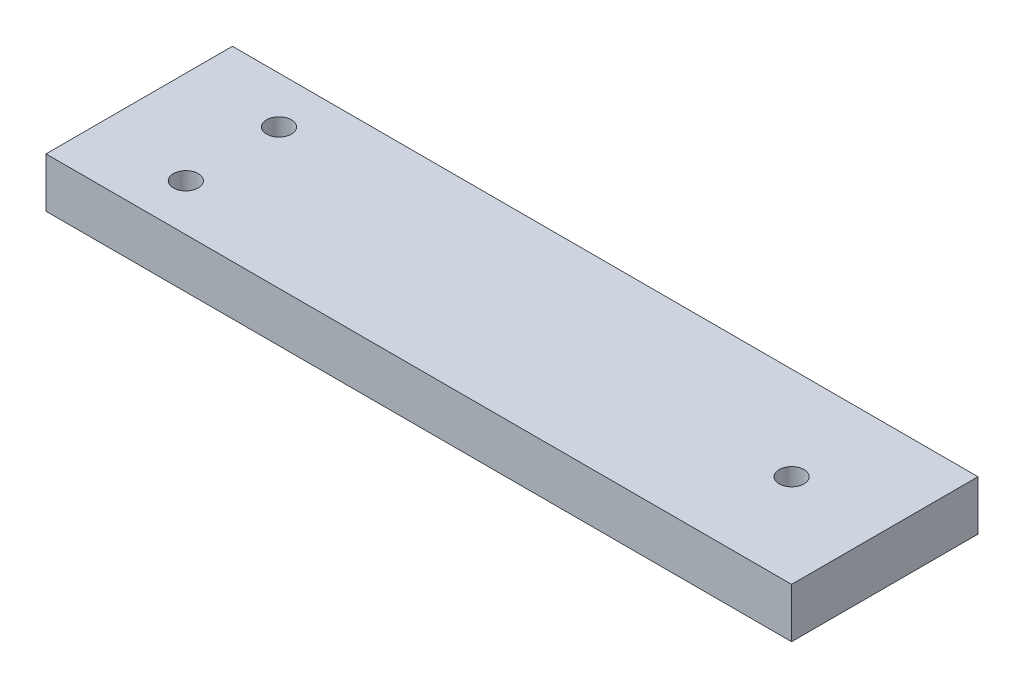
from build123d import *

# Parameters (mm, degrees)
SKETCH1_W           = 120
SKETCH1_H           = 30
SKETCH1_R           = 2
BOSS_EXTRUDE1_DEPTH = 8


with BuildPart() as part:
    # Sketch1 → Boss-Extrude1 (new body)
    with BuildSketch(Plane(origin=(0, 0, 0), x_dir=(1, 0, 0), z_dir=(0, 1, 0))):
        Rectangle(SKETCH1_W, SKETCH1_H)
        with Locations(Location((45, 0, 0), (0, 0, 270))):
            Circle(SKETCH1_R, mode=Mode.SUBTRACT)
        with Locations(Location((-45, -7.5, 0), (0, 0, 270))):
            Circle(SKETCH1_R, mode=Mode.SUBTRACT)
        with Locations(Location((-45, 7.5, 0), (0, 0, 270))):
            Circle(SKETCH1_R, mode=Mode.SUBTRACT)
    extrude(amount=BOSS_EXTRUDE1_DEPTH)


solid = part.part
